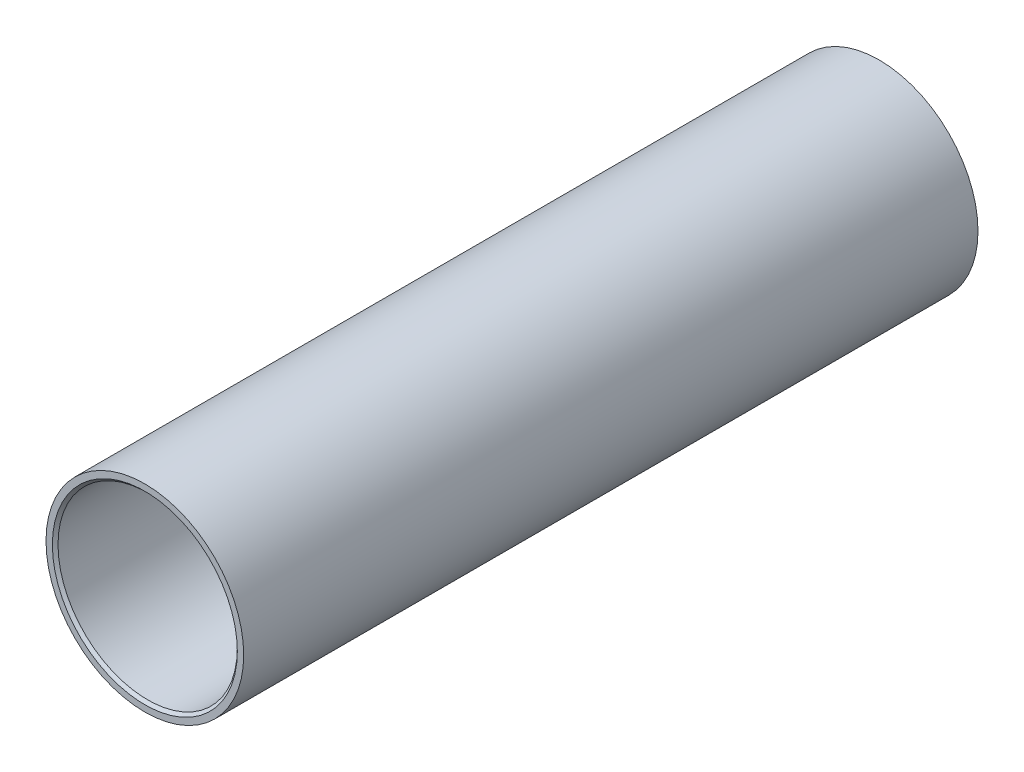
from build123d import *

# Parameters (mm, degrees)
IZIM1_R                     = 70
IZIM1_R_2                   = 63.5
Y_KSEKLIK_EKSTR_ZYON1_DEPTH = 520
PAH1_SIZE                   = 2


with BuildPart() as part:
    # Çizim1 → Yükseklik-Ekstrüzyon1 (new body)
    with BuildSketch(Plane.XY):
        Circle(IZIM1_R)
        Circle(IZIM1_R_2, mode=Mode.SUBTRACT)
    extrude(amount=Y_KSEKLIK_EKSTR_ZYON1_DEPTH)

    # Pah1
    pah1_edges = [part.edges().sort_by_distance(p)[0] for p in [
        (-63.5, 0, 0),
        (-63.5, 0, 520),
    ]]
    chamfer(pah1_edges, length=PAH1_SIZE)


solid = part.part
